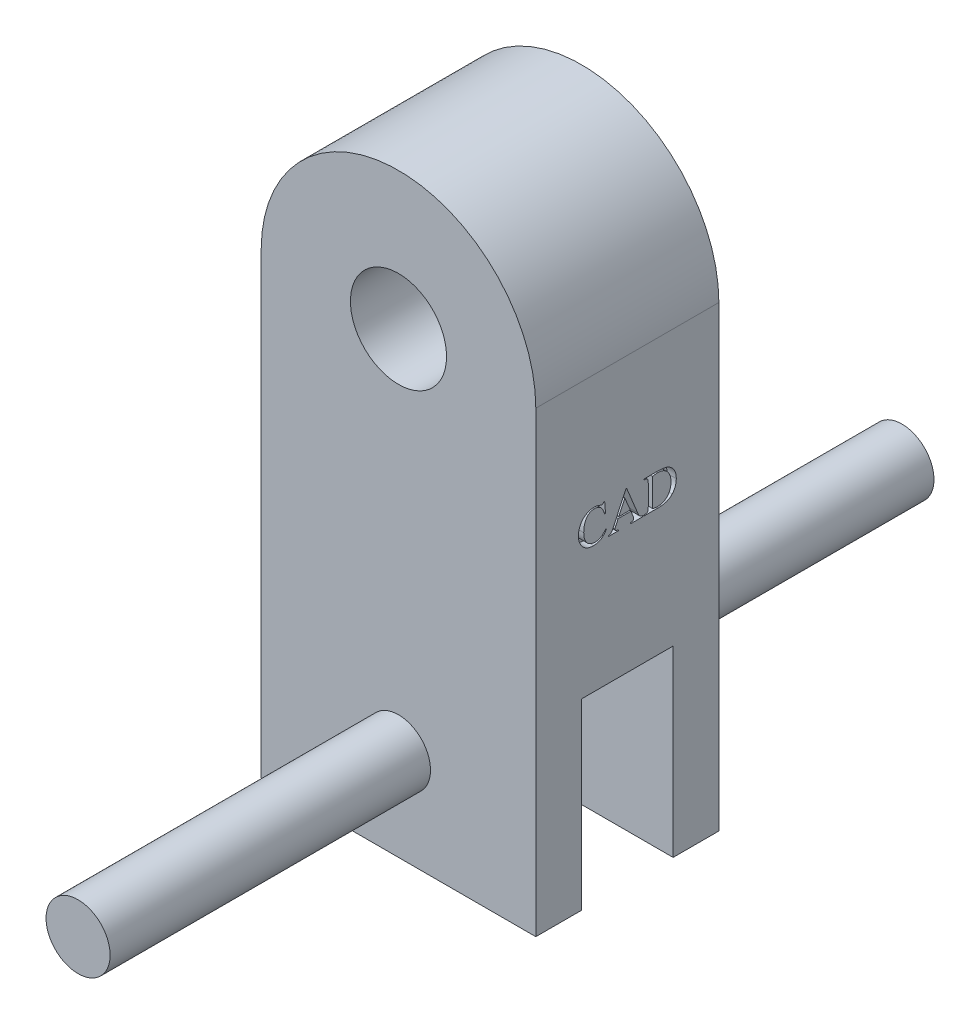
from build123d import *

# Parameters (mm, degrees)
SKETCH1_R               = 5.25
BOSS_EXTRUDE1_DEPTH     = 10
CUT_EXTRUDE2_DEPTH      = 54.150729064
CUT_EXTRUDE2_DEPTH_BACK = 54.150729064
SKETCH5_W               = 10
SKETCH5_H               = 20
SKETCH2_R               = 3.5
BOSS_EXTRUDE2_DEPTH     = 45
CUT_EXTRUDE3_DEPTH      = 1


with BuildPart() as part:
    # Sketch1 → Boss-Extrude1 (new, symmetric)
    with BuildSketch(Plane.XY):
        with BuildLine():
            Line((-15, 0), (-15, -50))
            Line((-15, -50), (15, -50))
            Line((15, -50), (15, 0))
            ThreePointArc((15, 0), (0, 15), (-15, 0))
        make_face()
        Circle(SKETCH1_R, mode=Mode.SUBTRACT)
    extrude(amount=BOSS_EXTRUDE1_DEPTH, both=True)

    # Sketch5 → Cut-Extrude2 (cut, two sides: drawn at the far end of the back side and taken through both)
    with BuildSketch(Plane(origin=(0, 0, 0), x_dir=(0, 0, -1), z_dir=(1, 0, 0)).offset(-CUT_EXTRUDE2_DEPTH_BACK)):
        with Locations((0, -40)):
            Rectangle(SKETCH5_W, SKETCH5_H)
    extrude(amount=CUT_EXTRUDE2_DEPTH + CUT_EXTRUDE2_DEPTH_BACK, mode=Mode.SUBTRACT)

    # Sketch2 → Boss-Extrude2 (add, symmetric)
    with BuildSketch(Plane.XY):
        with Locations(Location((0, -40, 0), (0, 0, 180))):
            Circle(SKETCH2_R)
    extrude(amount=BOSS_EXTRUDE2_DEPTH, both=True)

    # Sketch6 → Cut-Extrude3 (cut)
    # profile 1 of 3: a face of its own
    with BuildSketch(Plane(origin=(15, 0, 0), x_dir=(0, 0, -1), z_dir=(1, 0, 0))):
        with BuildLine():
            Line((-2.479166667, -12.559479363), (-2.381944444, -13.774757141))
            Line((-2.381944444, -13.774757141), (-2.479166667, -13.774757141))
            add(Edge.make_bspline(
                [(-2.479166667, -13.774757141), (-2.492089458, -13.728776721), (-2.517125488, -13.639696342), (-2.561766568, -13.512358389), (-2.608812794, -13.394454384), (-2.661591891, -13.287088546), (-2.717518708, -13.189186475), (-2.778433948, -13.101637281), (-2.84301279, -13.023638932), (-2.911753298, -12.955491181), (-2.984585159, -12.896659823), (-3.060664449, -12.845688575), (-3.140131763, -12.802010039), (-3.223180383, -12.76608725), (-3.310220911, -12.738521368), (-3.400939156, -12.720243058), (-3.494810184, -12.707112882), (-3.558690956, -12.705919168), (-3.591145833, -12.705312696)],
                knots=[0, 0, 0, 0, 1.365306606, 2.645083058, 3.856296657, 4.992683601, 6.063002854, 7.077131597, 8.038305781, 8.954596039, 9.839848101, 10.711227855, 11.569763097, 12.429061007, 13.294496621, 14.174761977, 15.072680662, 16, 16, 16, 16], degree=3))
            add(Edge.make_bspline(
                [(-3.591145833, -12.705312696), (-3.618501491, -12.706027865), (-3.672554965, -12.707441004), (-3.752618444, -12.714715445), (-3.830433935, -12.728839494), (-3.906577428, -12.74732988), (-3.980290686, -12.773161908), (-4.052853894, -12.802206914), (-4.122671243, -12.838345985), (-4.190661279, -12.879376304), (-4.255927192, -12.926331199), (-4.31790977, -12.979751195), (-4.375486886, -13.04007425), (-4.430073374, -13.106709808), (-4.48012238, -13.180456538), (-4.528812565, -13.259405239), (-4.571569193, -13.346030773), (-4.61205779, -13.438297095), (-4.647447072, -13.537115349), (-4.678636055, -13.64156566), (-4.705332227, -13.751550216), (-4.72603737, -13.867826789), (-4.744209497, -13.989547261), (-4.754532979, -14.117693999), (-4.762945143, -14.251136409), (-4.763570397, -14.34212476), (-4.763888889, -14.388472419)],
                knots=[0, 0, 0, 0, 0.852545564, 1.684589362, 2.501652392, 3.314783632, 4.123040609, 4.933143274, 5.748109165, 6.569312519, 7.405645712, 8.25016084, 9.114918083, 10.000754889, 10.930732154, 11.889927012, 12.888317242, 13.937610583, 15.028084188, 16.156171809, 17.332859433, 18.552090647, 19.835038534, 21.165583881, 22.556204723, 24, 24, 24, 24], degree=3))
            add(Edge.make_bspline(
                [(-4.763888889, -14.388472419), (-4.763462808, -14.426966391), (-4.762623972, -14.502750533), (-4.755673339, -14.614263014), (-4.744302214, -14.721976698), (-4.72846114, -14.825662691), (-4.70822438, -14.92569922), (-4.681981468, -15.0213114), (-4.652567461, -15.113486194), (-4.61870227, -15.201798486), (-4.579001551, -15.284989976), (-4.535764249, -15.364036626), (-4.487140202, -15.437627316), (-4.433634688, -15.506283766), (-4.37599323, -15.570256426), (-4.313508686, -15.628963377), (-4.246221274, -15.682240947), (-4.174947554, -15.730822774), (-4.09985825, -15.774127103), (-4.021577436, -15.811322807), (-3.940714943, -15.842409577), (-3.857522812, -15.868393258), (-3.771794878, -15.888962837), (-3.683203606, -15.903399845), (-3.592066489, -15.911730947), (-3.530398677, -15.913003208), (-3.499240451, -15.91364603)],
                knots=[0, 0, 0, 0, 1.236646645, 2.434620225, 3.588021171, 4.71542926, 5.803413575, 6.864987612, 7.89909351, 8.911178466, 9.900886288, 10.858450138, 11.803739474, 12.731186558, 13.652621421, 14.567606934, 15.482266978, 16.407285251, 17.336514176, 18.264317902, 19.188799549, 20.117565524, 21.062609844, 22.018756131, 22.998958452, 24, 24, 24, 24], degree=3))
            add(Edge.make_bspline(
                [(-3.499240451, -15.91364603), (-3.445959382, -15.912193052), (-3.341776386, -15.909351977), (-3.190518909, -15.882714573), (-3.048676385, -15.840403419), (-2.937336056, -15.789874367), (-2.85240245, -15.737904344), (-2.786564575, -15.691404084), (-2.72002831, -15.635527311), (-2.651590962, -15.571614809), (-2.58185979, -15.498937227), (-2.509417458, -15.418744278), (-2.437024358, -15.328854609), (-2.389121225, -15.265623297), (-2.364474826, -15.233090474)],
                knots=[0, 0, 0, 0, 1.384369864, 2.706923932, 3.979392615, 5.225429667, 5.872362172, 6.566477539, 7.319183729, 8.12964106, 9.000244434, 9.937306366, 10.938733914, 12, 12, 12, 12], degree=3))
            Line((-2.364474826, -15.233090474), (-2.284722222, -15.281701585))
            add(Edge.make_bspline(
                [(-2.284722222, -15.281701585), (-2.306182311, -15.318350298), (-2.348331129, -15.390330428), (-2.415649175, -15.492938785), (-2.486466948, -15.587535321), (-2.56049173, -15.674102447), (-2.635923446, -15.754159379), (-2.714923316, -15.825872122), (-2.795810209, -15.890904689), (-2.880863334, -15.947091294), (-2.968510778, -15.996944836), (-3.060325045, -16.039550349), (-3.155738455, -16.075901911), (-3.255193676, -16.105849597), (-3.358877697, -16.1283333), (-3.466392663, -16.145029925), (-3.578036244, -16.155205644), (-3.653660457, -16.15619688), (-3.692165799, -16.156701585)],
                knots=[0, 0, 0, 0, 1.164115463, 2.286388121, 3.362177995, 4.401064794, 5.407448869, 6.375280312, 7.323730291, 8.2496411, 9.166480924, 10.085577234, 11.021398032, 11.963401182, 12.930012424, 13.927332932, 14.944666635, 16, 16, 16, 16], degree=3))
            add(Edge.make_bspline(
                [(-3.692165799, -16.156701585), (-3.726867709, -16.156348104), (-3.79534533, -16.155650576), (-3.896466665, -16.147593803), (-3.994874681, -16.135670871), (-4.090342801, -16.118529417), (-4.182543922, -16.094915476), (-4.272408977, -16.069416701), (-4.358430899, -16.035808323), (-4.441861704, -15.999115555), (-4.52222527, -15.956869094), (-4.599761916, -15.909925295), (-4.674116293, -15.85731932), (-4.745620248, -15.800248323), (-4.81437467, -15.738626045), (-4.879648949, -15.671273983), (-4.942845097, -15.599701774), (-4.981452926, -15.548318266), (-5.000868056, -15.522478495)],
                knots=[0, 0, 0, 0, 1.099867591, 2.170379506, 3.21370673, 4.241732154, 5.242319988, 6.230208013, 7.200627964, 8.167156574, 9.118536317, 10.076596279, 11.038581839, 12.003776478, 12.975622664, 13.963217193, 14.975741399, 16, 16, 16, 16], degree=3))
            add(Edge.make_bspline(
                [(-5.000868056, -15.522478495), (-5.028700169, -15.482693437), (-5.083967154, -15.403691167), (-5.153697538, -15.276851985), (-5.214021969, -15.145828168), (-5.262721137, -15.008753457), (-5.300889961, -14.866812321), (-5.326827146, -14.719351563), (-5.344557759, -14.567144343), (-5.346325536, -14.463719846), (-5.347222222, -14.411258877)],
                knots=[0, 0, 0, 0, 0.983524538, 1.953011393, 2.929009533, 3.904562341, 4.897931762, 5.904535192, 6.937097918, 8, 8, 8, 8], degree=3))
            add(Edge.make_bspline(
                [(-5.347222222, -14.411258877), (-5.346375445, -14.36870712), (-5.344699827, -14.284504886), (-5.334873498, -14.159426073), (-5.31762051, -14.037088014), (-5.291936145, -13.917611753), (-5.26128249, -13.800159647), (-5.222288442, -13.685620666), (-5.176761158, -13.573700418), (-5.124190676, -13.465303274), (-5.066349863, -13.360588626), (-5.001439234, -13.262091872), (-4.932375308, -13.168902583), (-4.857721401, -13.08211793), (-4.777799034, -13.001377146), (-4.692508843, -12.92675166), (-4.601878423, -12.858244969), (-4.506409595, -12.796114696), (-4.406978454, -12.740963364), (-4.305200883, -12.692034125), (-4.200860318, -12.650947676), (-4.094263567, -12.617437748), (-3.985611926, -12.591574842), (-3.874668659, -12.57353782), (-3.761546061, -12.561578965), (-3.685107219, -12.560182821), (-3.646592882, -12.559479363)],
                knots=[0, 0, 0, 0, 1.092083487, 2.161035764, 3.217773312, 4.260190825, 5.295679875, 6.331270849, 7.362920202, 8.394590017, 9.421399, 10.430623911, 11.419565072, 12.396371527, 13.365824252, 14.332813307, 15.302266032, 16.279072486, 17.253498857, 18.218389939, 19.175218244, 20.128753647, 21.083815363, 22.038788663, 23.011827579, 24, 24, 24, 24], degree=3))
            add(Edge.make_bspline(
                [(-3.646592882, -12.559479363), (-3.586218982, -12.561164049), (-3.465073811, -12.564544509), (-3.284780118, -12.59425176), (-3.105261155, -12.639812108), (-2.989666879, -12.685302184), (-2.93109809, -12.708350891)],
                knots=[0, 0, 0, 0, 0.984356359, 1.975191602, 2.974079167, 4, 4, 4, 4], degree=3))
            add(Edge.make_bspline(
                [(-2.93109809, -12.708350891), (-2.915214777, -12.715112081), (-2.885990523, -12.727552228), (-2.845498281, -12.741941893), (-2.812251817, -12.751344633), (-2.792393086, -12.753141407), (-2.78374566, -12.753923807)],
                knots=[0, 0, 0, 0, 1.336236462, 2.458587416, 3.328796419, 4, 4, 4, 4], degree=3))
            add(Edge.make_bspline(
                [(-2.78374566, -12.753923807), (-2.762393172, -12.752360614), (-2.720207173, -12.74927222), (-2.684947617, -12.725946608), (-2.667534722, -12.71442728)],
                knots=[0, 0, 0, 0, 1.012302122, 2, 2, 2, 2], degree=3))
            add(Edge.make_bspline(
                [(-2.667534722, -12.71442728), (-2.657258814, -12.704644768), (-2.63626857, -12.684662367), (-2.6118632, -12.647508584), (-2.590536614, -12.605905487), (-2.581230183, -12.575366194), (-2.576388889, -12.559479363)],
                knots=[0, 0, 0, 0, 0.931295945, 1.90232619, 2.908770141, 4, 4, 4, 4], degree=3))
            Line((-2.576388889, -12.559479363), (-2.479166667, -12.559479363))
        make_face()
    # profile 2 of 3: a face of its own
    with BuildSketch(Plane(origin=(15, 0, 0), x_dir=(0, 0, -1), z_dir=(1, 0, 0))):
        with BuildLine():
            Line((0.387369792, -14.941423807), (-1.007921007, -14.941423807))
            Line((-1.007921007, -14.941423807), (-1.263888889, -15.492856099))
            add(Edge.make_bspline(
                [(-1.263888889, -15.492856099), (-1.276961609, -15.524101246), (-1.30107259, -15.581728976), (-1.328514496, -15.66334081), (-1.347258827, -15.732294158), (-1.350016512, -15.774817728), (-1.351236979, -15.793637349)],
                knots=[0, 0, 0, 0, 1.290094603, 2.37941668, 3.282779777, 4, 4, 4, 4], degree=3))
            add(Edge.make_bspline(
                [(-1.351236979, -15.793637349), (-1.350475014, -15.806709217), (-1.348960825, -15.832685822), (-1.332862862, -15.869670224), (-1.309046478, -15.904066977), (-1.281674229, -15.930468562), (-1.253374383, -15.948878137), (-1.226116599, -15.961973272), (-1.193193758, -15.973171681), (-1.154689649, -15.982534778), (-1.110886923, -15.99175169), (-1.061818877, -16.000334828), (-1.006956652, -16.005850779), (-0.968680331, -16.00914606), (-0.948676215, -16.010868252)],
                knots=[0, 0, 0, 0, 0.928346294, 1.844823155, 2.832693264, 3.906787277, 4.533555799, 5.236980931, 6.060283213, 7.011752617, 8.064797478, 9.256587662, 10.566227436, 12, 12, 12, 12], degree=3))
            Line((-0.948676215, -16.010868252), (-0.948676215, -16.108090474))
            Line((-0.948676215, -16.108090474), (-2.047743056, -16.108090474))
            Line((-2.047743056, -16.108090474), (-2.047743056, -16.010868252))
            add(Edge.make_bspline(
                [(-2.047743056, -16.010868252), (-2.014440218, -16.004041328), (-1.953891781, -15.991629185), (-1.873299929, -15.967774686), (-1.810678387, -15.941311344), (-1.779520602, -15.916748392), (-1.765950521, -15.906050544)],
                knots=[0, 0, 0, 0, 1.341417684, 2.438853554, 3.320077337, 4, 4, 4, 4], degree=3))
            add(Edge.make_bspline(
                [(-1.765950521, -15.906050544), (-1.754606014, -15.894076601), (-1.730471913, -15.86860345), (-1.696199291, -15.823831232), (-1.66158988, -15.770547893), (-1.626155129, -15.709031442), (-1.589553628, -15.639294109), (-1.551772041, -15.561658782), (-1.513775898, -15.475058199), (-1.488839904, -15.414422764), (-1.475802951, -15.382721551)],
                knots=[0, 0, 0, 0, 0.657509844, 1.398774721, 2.244567789, 3.190193186, 4.229071695, 5.385194885, 6.63293641, 8, 8, 8, 8], degree=3))
            Line((-1.475802951, -15.382721551), (-0.163302951, -12.559479363))
            Line((-0.163302951, -12.559479363), (-0.067599826, -12.559479363))
            Line((-0.067599826, -12.559479363), (1.118055556, -15.444244988))
            add(Edge.make_bspline(
                [(1.118055556, -15.444244988), (1.129702258, -15.471956217), (1.152101695, -15.525251644), (1.188417185, -15.600210547), (1.221852321, -15.668604571), (1.255463966, -15.728848271), (1.287968626, -15.781460072), (1.319788473, -15.826481869), (1.350778775, -15.864093796), (1.3916071, -15.904008914), (1.448372545, -15.94439175), (1.527570979, -15.977892528), (1.617327057, -16.001977036), (1.681478594, -16.007813151), (1.715060764, -16.010868252)],
                knots=[0, 0, 0, 0, 1.223989839, 2.354029848, 3.391605643, 4.324042249, 5.162387765, 5.909171864, 6.567979791, 7.144041755, 8.231258465, 9.380841669, 10.628917946, 12, 12, 12, 12], degree=3))
            Line((1.715060764, -16.010868252), (1.715060764, -16.108090474))
            Line((1.715060764, -16.108090474), (0.33344184, -16.108090474))
            Line((0.33344184, -16.108090474), (0.33344184, -16.010868252))
            add(Edge.make_bspline(
                [(0.33344184, -16.010868252), (0.365434983, -16.008813416), (0.424217134, -16.005037993), (0.50332123, -15.989763683), (0.566846631, -15.970785344), (0.61379876, -15.942569892), (0.647023807, -15.909253817), (0.670335135, -15.872986166), (0.684895476, -15.83317735), (0.686553209, -15.805403435), (0.687391493, -15.791358703)],
                knots=[0, 0, 0, 0, 1.654818352, 3.040457217, 4.157564338, 5.061856313, 5.838989301, 6.56851638, 7.276126429, 8, 8, 8, 8], degree=3))
            add(Edge.make_bspline(
                [(0.687391493, -15.791358703), (0.686026767, -15.768978095), (0.682916329, -15.71796893), (0.660223975, -15.634284941), (0.628990964, -15.533385362), (0.600362863, -15.461775283), (0.584852431, -15.422977627)],
                knots=[0, 0, 0, 0, 0.698820548, 1.592729354, 2.695763756, 4, 4, 4, 4], degree=3))
            Line((0.584852431, -15.422977627), (0.387369792, -14.941423807))
        make_face()
        Polygon((0.327365451, -14.795590474), (-0.267361111, -13.390425544), (-0.940321181, -14.795590474), align=None, mode=Mode.SUBTRACT)
    # profile 3 of 3: a face of its own
    with BuildSketch(Plane(origin=(15, 0, 0), x_dir=(0, 0, -1), z_dir=(1, 0, 0))):
        with BuildLine():
            Line((1.798611111, -16.108090474), (1.798611111, -16.010868252))
            Line((1.798611111, -16.010868252), (1.925455729, -16.010868252))
            add(Edge.make_bspline(
                [(1.925455729, -16.010868252), (1.94269559, -16.010461379), (1.976054155, -16.009674093), (2.024203534, -16.002765463), (2.068557817, -15.991423556), (2.10914652, -15.975763373), (2.145162767, -15.954495297), (2.178516926, -15.930591328), (2.206865741, -15.900351448), (2.222243102, -15.877415819), (2.230034722, -15.865794467)],
                knots=[0, 0, 0, 0, 1.170016541, 2.263943595, 3.293731011, 4.273677885, 5.205400736, 6.126759273, 7.050839703, 8, 8, 8, 8], degree=3))
            add(Edge.make_bspline(
                [(2.230034722, -15.865794467), (2.234563795, -15.857543858), (2.24453416, -15.839380848), (2.255529208, -15.807081458), (2.26418142, -15.768313256), (2.271860574, -15.722929295), (2.277579523, -15.670935062), (2.282363336, -15.611932476), (2.284253752, -15.546289941), (2.284561583, -15.500198534), (2.284722222, -15.47614603)],
                knots=[0, 0, 0, 0, 0.568141805, 1.250715472, 2.052584266, 2.968455247, 4.031571596, 5.213625719, 6.545948453, 8, 8, 8, 8], degree=3))
            Line((2.284722222, -15.47614603), (2.284722222, -13.240034919))
            add(Edge.make_bspline(
                [(2.284722222, -13.240034919), (2.284757891, -13.213442373), (2.284825534, -13.163010593), (2.280470722, -13.091108215), (2.275703804, -13.026938433), (2.2682577, -12.970618795), (2.258551744, -12.922037851), (2.246458618, -12.881501377), (2.233690521, -12.847405479), (2.220779095, -12.82967451), (2.21484375, -12.821523634)],
                knots=[0, 0, 0, 0, 1.484107705, 2.814555366, 4.019988359, 5.075390106, 5.984573864, 6.780592097, 7.4394417, 8, 8, 8, 8], degree=3))
            add(Edge.make_bspline(
                [(2.21484375, -12.821523634), (2.197425358, -12.803552104), (2.162409424, -12.767424203), (2.093353563, -12.730615704), (2.013057773, -12.709391265), (1.955727971, -12.706722109), (1.925455729, -12.705312696)],
                knots=[0, 0, 0, 0, 0.928124107, 1.865794122, 2.873060895, 4, 4, 4, 4], degree=3))
            Line((1.925455729, -12.705312696), (1.798611111, -12.705312696))
            Line((1.798611111, -12.705312696), (1.798611111, -12.608090474))
            Line((1.798611111, -12.608090474), (3.232638889, -12.608090474))
            add(Edge.make_bspline(
                [(3.232638889, -12.608090474), (3.296451073, -12.608690174), (3.420334135, -12.609854413), (3.600191756, -12.618332644), (3.768490729, -12.63153205), (3.924615571, -12.651126276), (4.069085615, -12.676256501), (4.201963518, -12.705963448), (4.323030482, -12.742336206), (4.433192537, -12.784552086), (4.535265349, -12.832929055), (4.630739702, -12.889342744), (4.721418408, -12.952522319), (4.807294779, -13.022832643), (4.887440316, -13.101182542), (4.963134497, -13.186514085), (5.032971887, -13.279798327), (5.097993259, -13.379330679), (5.15648451, -13.484882795), (5.207315957, -13.595133059), (5.250655327, -13.709353584), (5.286655715, -13.82749414), (5.313987591, -13.949900516), (5.33232782, -14.076387287), (5.345408394, -14.206668242), (5.346611492, -14.29501417), (5.347222222, -14.339861307)],
                knots=[0, 0, 0, 0, 1.467398357, 2.848763231, 4.139747069, 5.348651221, 6.465709142, 7.510884705, 8.477890948, 9.369935066, 10.221521294, 11.072291092, 11.917022873, 12.760911509, 13.621447043, 14.491775058, 15.381421868, 16.298684439, 17.223858558, 18.153856654, 19.088127867, 20.031156851, 20.991691223, 21.969088183, 22.969046064, 24, 24, 24, 24], degree=3))
            add(Edge.make_bspline(
                [(5.347222222, -14.339861307), (5.346044825, -14.399681906), (5.343737074, -14.516933027), (5.321580837, -14.688940182), (5.286973014, -14.853438164), (5.238408797, -15.010801512), (5.175047216, -15.160321089), (5.097567288, -15.302184007), (5.007844221, -15.437844155), (4.936496502, -15.519926799), (4.900607639, -15.561215474)],
                knots=[0, 0, 0, 0, 1.077719575, 2.112379846, 3.120154608, 4.104514829, 5.075810074, 6.041644454, 7.014920789, 8, 8, 8, 8], degree=3))
            add(Edge.make_bspline(
                [(4.900607639, -15.561215474), (4.879376851, -15.583536129), (4.836764407, -15.62833605), (4.767521406, -15.69027493), (4.694532989, -15.748194731), (4.617305577, -15.801568698), (4.536191526, -15.850845664), (4.450805121, -15.895962969), (4.360974516, -15.935828098), (4.267614167, -15.972570772), (4.169852227, -16.004308503), (4.068291246, -16.032468152), (3.962329631, -16.056088739), (3.852234202, -16.074683669), (3.738275534, -16.090103414), (3.62017542, -16.100631901), (3.498037548, -16.106619651), (3.415190263, -16.1075954), (3.373155382, -16.108090474)],
                knots=[0, 0, 0, 0, 0.884547214, 1.775380039, 2.665826882, 3.559504879, 4.469980105, 5.390593375, 6.331323642, 7.291529335, 8.271228182, 9.282197471, 10.317896576, 11.387954191, 12.488469157, 13.620281033, 14.792583212, 16, 16, 16, 16], degree=3))
            Line((3.373155382, -16.108090474), (1.798611111, -16.108090474))
        make_face()
        with BuildLine():
            add(Edge.make_bspline(
                [(2.770833333, -15.887821377), (2.824655342, -15.899298813), (2.927344883, -15.921197152), (3.075780945, -15.943279382), (3.210259674, -15.959435614), (3.295640731, -15.961352459), (3.3359375, -15.962257141)],
                knots=[0, 0, 0, 0, 1.156263879, 2.206090244, 3.153339526, 4, 4, 4, 4], degree=3))
            add(Edge.make_bspline(
                [(3.3359375, -15.962257141), (3.386143159, -15.961005132), (3.484959784, -15.958540882), (3.629663812, -15.937271537), (3.768224687, -15.904127548), (3.900217724, -15.856885024), (4.025522695, -15.795749023), (4.143998391, -15.720882875), (4.255076839, -15.63180167), (4.360019079, -15.531428209), (4.454396206, -15.418367149), (4.537976134, -15.295544044), (4.607908817, -15.162673213), (4.664965465, -15.020291268), (4.709939654, -14.86852332), (4.741429907, -14.706780642), (4.760773883, -14.535538652), (4.762834622, -14.418147414), (4.763888889, -14.358090474)],
                knots=[0, 0, 0, 0, 0.997996022, 1.964292496, 2.902202989, 3.827540679, 4.746320531, 5.669683403, 6.608607029, 7.573643287, 8.552931756, 9.531909504, 10.522958759, 11.532773866, 12.577887131, 13.666093008, 14.805981493, 16, 16, 16, 16], degree=3))
            add(Edge.make_bspline(
                [(4.763888889, -14.358090474), (4.762837076, -14.297528052), (4.760785154, -14.179380329), (4.741516216, -14.007362526), (4.709829734, -13.845155314), (4.664956584, -13.692870832), (4.608062177, -13.549903497), (4.538148893, -13.416978813), (4.454414777, -13.29471271), (4.359702739, -13.182519797), (4.255209802, -13.081574221), (4.142355397, -12.993761655), (4.022071666, -12.919626976), (3.894843141, -12.858059192), (3.759296246, -12.812483268), (3.617688438, -12.777587105), (3.468397432, -12.757921176), (3.366627607, -12.755274857), (3.314670139, -12.753923807)],
                knots=[0, 0, 0, 0, 1.193396302, 2.328127765, 3.406675227, 4.447298146, 5.452780722, 6.435033879, 7.401194227, 8.367973033, 9.324444072, 10.259799173, 11.180785527, 12.104889921, 13.03919269, 13.994204462, 14.975963072, 16, 16, 16, 16], degree=3))
            add(Edge.make_bspline(
                [(3.314670139, -12.753923807), (3.273617249, -12.754826274), (3.188238805, -12.75670315), (3.056316311, -12.772053201), (2.915910702, -12.796532194), (2.820352398, -12.818996854), (2.770833333, -12.830638217)],
                knots=[0, 0, 0, 0, 0.894670856, 1.860663297, 2.891378894, 4, 4, 4, 4], degree=3))
            Line((2.770833333, -12.830638217), (2.770833333, -15.887821377))
        make_face(mode=Mode.SUBTRACT)
    extrude(amount=-CUT_EXTRUDE3_DEPTH, mode=Mode.SUBTRACT)


solid = part.part
